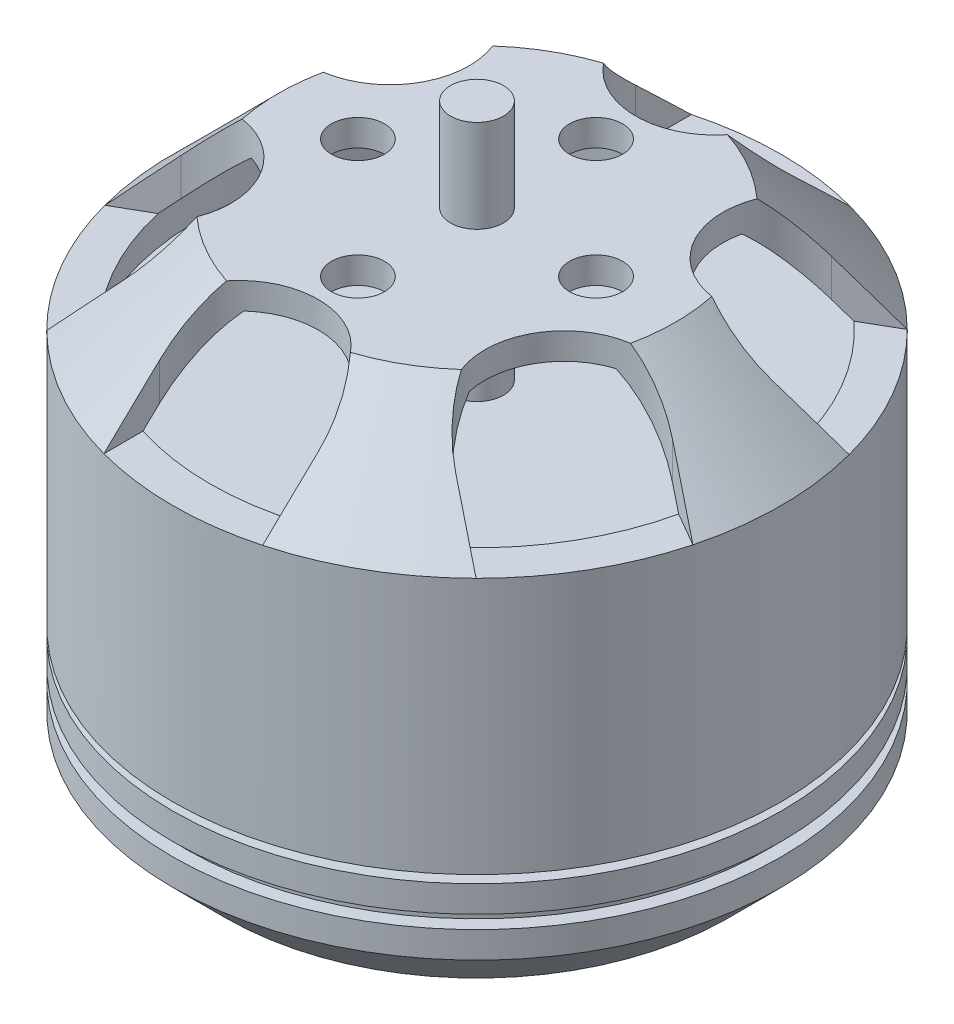
from build123d import *

# Parameters (mm, degrees)
SKETCH2_R          = 1
CUT_EXTRUDE1_DEPTH = 4
SKETCH3_R          = 1
CUT_EXTRUDE2_DEPTH = 3


with BuildPart() as part:
    # Sketch1 → Revolve1 (revolve)
    with BuildSketch(Plane.XY, mode=Mode.PRIVATE) as revolve1_sk:
        Polygon((0, 18.470552147), (0, 0), (0, -5.329447853), (1, -5.329447853), (1, -3.529447853), (9.5, -3.529447853), (11.5, -1.529447853), (11.5, -0.529447853), (11, -0.529447853), (11, -0.029447853), (11.5, -0.029447853), (11.5, 0.970552147), (9.5, 0.970552147), (9.5, 1.270552147), (11.5, 1.270552147), (11.5, 10.970552147), (7.5, 14.970552147), (1, 14.970552147), (1, 18.470552147), align=None)
        Polygon((2, 13.970552147), (7.085786438, 13.970552147), (10.5, 10.556338585), (10.5, 9.331929575), (1, 9.331929575), (1, 12.970552147), (2, 12.970552147), align=None, mode=Mode.SUBTRACT)
    revolve(revolve1_sk.sketch.rotate(Axis((0, 18.470552147, 0), (0, -1, 0)), 90), axis=Axis((0, 18.470552147, 0), (0, -1, 0)))

    # Sketch2 → Cut-Extrude1 (cut)
    with BuildSketch(Plane(origin=(0, 14.970552147, 0), x_dir=(1, 0, 0), z_dir=(0, 1, 0))):
        with Locations(Location((0, -4.5, 0), (0, 0, 270))):
            Circle(SKETCH2_R)
        with Locations(Location((-4.5, 0, 0), (0, 0, 270))):
            Circle(SKETCH2_R)
        with Locations(Location((0, 4.5, 0), (0, 0, 270))):
            Circle(SKETCH2_R)
        with Locations(Location((4.5, 0, 0), (0, 0, 270))):
            Circle(SKETCH2_R)
        with BuildLine():
            Line((-3, 9), (-3, 15.381415119))
            Line((-3, 15.381415119), (3, 15.381415119))
            Line((3, 15.381415119), (3, 9))
            ThreePointArc((3, 9), (0, 6), (-3, 9))
        make_face()
        with BuildLine():
            Line((14.820696239, 5.092631348), (9.294228634, 1.901923789))
            ThreePointArc((9.294228634, 1.901923789), (5.196152423, 3), (6.294228634, 7.098076211))
            Line((6.294228634, 7.098076211), (11.820696239, 10.288783771))
            Line((11.820696239, 10.288783771), (14.820696239, 5.092631348))
        make_face()
        with BuildLine():
            Line((11.820696239, -10.288783771), (6.294228634, -7.098076211))
            ThreePointArc((6.294228634, -7.098076211), (5.196152423, -3), (9.294228634, -1.901923789))
            Line((9.294228634, -1.901923789), (14.820696239, -5.092631348))
            Line((14.820696239, -5.092631348), (11.820696239, -10.288783771))
        make_face()
        with BuildLine():
            Line((-3, -15.381415119), (-3, -9))
            ThreePointArc((-3, -9), (0, -6), (3, -9))
            Line((3, -9), (3, -15.381415119))
            Line((3, -15.381415119), (-3, -15.381415119))
        make_face()
        with BuildLine():
            Line((-14.820696239, -5.092631348), (-9.294228634, -1.901923789))
            ThreePointArc((-9.294228634, -1.901923789), (-5.196152423, -3), (-6.294228634, -7.098076211))
            Line((-6.294228634, -7.098076211), (-11.820696239, -10.288783771))
            Line((-11.820696239, -10.288783771), (-14.820696239, -5.092631348))
        make_face()
        with BuildLine():
            Line((-11.820696239, 10.288783771), (-6.294228634, 7.098076211))
            ThreePointArc((-6.294228634, 7.098076211), (-5.196152423, 3), (-9.294228634, 1.901923789))
            Line((-9.294228634, 1.901923789), (-14.820696239, 5.092631348))
            Line((-14.820696239, 5.092631348), (-11.820696239, 10.288783771))
        make_face()
    extrude(amount=-CUT_EXTRUDE1_DEPTH, mode=Mode.SUBTRACT)

    # Sketch3 → Cut-Extrude2 (cut)
    with BuildSketch(Plane.XZ.offset(3.529447853)):
        with Locations(Location((0, 6, 0), (0, 0, 270))):
            Circle(SKETCH3_R)
        with Locations(Location((0, -6, 0), (0, 0, 270))):
            Circle(SKETCH3_R)
        with Locations(Location((-8, 0, 0), (0, 0, 270))):
            Circle(SKETCH3_R)
        with Locations(Location((8, 0, 0), (0, 0, 270))):
            Circle(SKETCH3_R)
    extrude(amount=-CUT_EXTRUDE2_DEPTH, mode=Mode.SUBTRACT)


solid = part.part
